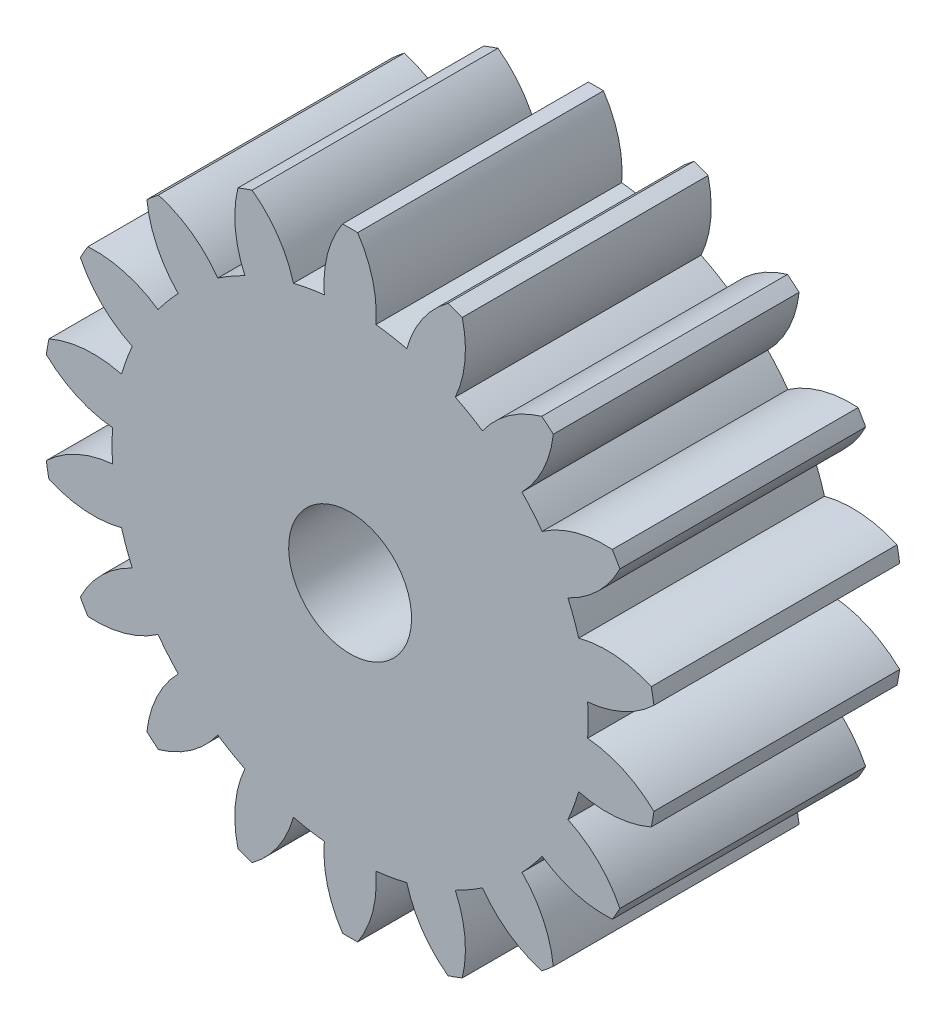
from build123d import *

# Parameters (mm, degrees)
BASPROSKE_W           = 4
BASPROSKE_H           = 5
TOOTHCUT_DEPTH        = 9.124038405
TEETHCUTS_COUNT       = 18
TEETHCUTS_ANGLE       = 340
BORSKE_R              = 1
BORE_DEPTH            = 50.0000508
BODY_MOVE_COPY1_ANGLE = 90
BODY_MOVE_COPY2_ANGLE = 90


with BuildPart() as part:
    # BasProSke → Base-Revolve (revolve)
    with BuildSketch(Plane(origin=(0, 0, 0), x_dir=(1, 0, 0), z_dir=(0, 1, 0)), mode=Mode.PRIVATE) as base_revolve_sk:
        with Locations((2, 2.5)):
            Rectangle(BASPROSKE_W, BASPROSKE_H)
    revolve(base_revolve_sk.sketch.rotate(Axis((-10, 0, 0), (1, 0, 0)), 180), axis=Axis((-10, 0, 0), (1, 0, 0)))

    # TooCutSke → ToothCut (cut, through all)
    with BuildSketch(Plane(origin=(0, 0, 0), x_dir=(0, 0, -1), z_dir=(1, 0, 0))):
        with BuildLine():
            ThreePointArc((0.25527463, 3.865580275), (0, 3.874), (-0.25527463, 3.865580275))
            ThreePointArc((-0.25527463, 3.865580275), (-0.416281865, 4.46052923), (-0.768562654, 4.96628197))
            ThreePointArc((-0.768562654, 4.96628197), (0, 5.0254), (0.768562654, 4.96628197))
            ThreePointArc((0.768562654, 4.96628197), (0.416281865, 4.46052923), (0.25527463, 3.865580275))
        make_face()
    toothcut = extrude(amount=TOOTHCUT_DEPTH, mode=Mode.SUBTRACT)

    # TeethCuts: ToothCut ×18 about axis
    teethcuts_axis = Axis((-10, 0, 0), (1, 0, 0))
    for i in range(1, TEETHCUTS_COUNT):
        add(toothcut.rotate(teethcuts_axis, i * TEETHCUTS_ANGLE / (TEETHCUTS_COUNT - 1)), mode=Mode.SUBTRACT)

    # BorSke → Bore (cut, symmetric)
    with BuildSketch(Plane(origin=(0, 0, 0), x_dir=(0, 0, -1), z_dir=(1, 0, 0))):
        with Locations(Location((0, 0, 0), (0, 0, 180))):
            Circle(BORSKE_R)
    extrude(amount=BORE_DEPTH, both=True, mode=Mode.SUBTRACT)


with BuildPart() as part_1:
    # Body-Move/Copy1: moved
    add(part.part.rotate(Axis((2, 0, 0), (0, 0, -1)), BODY_MOVE_COPY1_ANGLE))


with BuildPart() as part_2:
    # Body-Move/Copy2: moved
    add(part_1.part.rotate(Axis((0, 0, 0), (-1, 0, 0)), BODY_MOVE_COPY2_ANGLE))


solid = part_2.part
